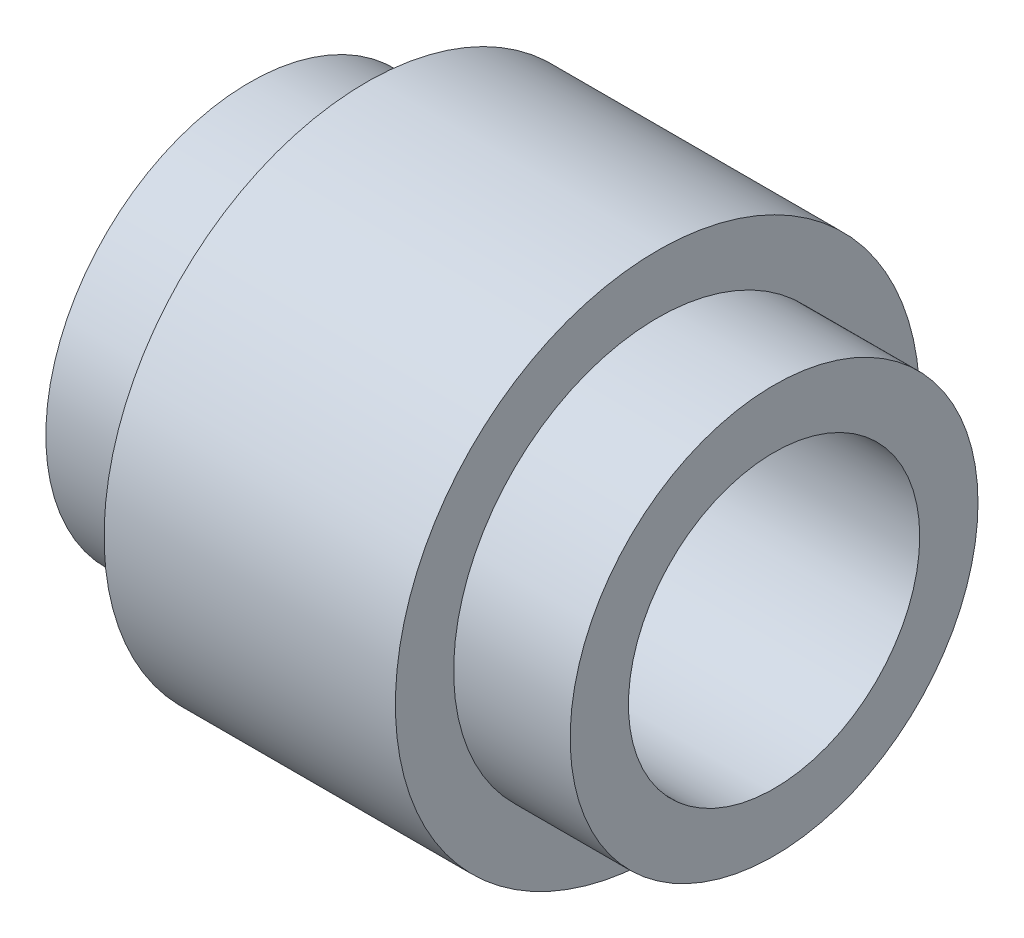
from build123d import *

# Parameters (mm, degrees)
SKETCH1_R           = 114.3
SKETCH1_R_2         = 63.5
BOSS_EXTRUDE1_DEPTH = 63.5
SKETCH2_R           = 88.9
SKETCH2_R_2         = 63.5
BOSS_EXTRUDE2_DEPTH = 50.8


with BuildPart() as part:
    # Sketch1 → Boss-Extrude1 (new, symmetric)
    with BuildSketch(Plane(origin=(0, 0, 0), x_dir=(0, 0, -1), z_dir=(1, 0, 0))):
        Circle(SKETCH1_R)
        Circle(SKETCH1_R_2, mode=Mode.SUBTRACT)
    extrude(amount=BOSS_EXTRUDE1_DEPTH, both=True)

    # Sketch2 → Boss-Extrude2 (add)
    with BuildSketch(Plane(origin=(63.5, 0, 0), x_dir=(0, 0, -1), z_dir=(1, 0, 0))):
        Circle(SKETCH2_R)
        Circle(SKETCH2_R_2, mode=Mode.SUBTRACT)
    boss_extrude2 = extrude(amount=BOSS_EXTRUDE2_DEPTH)

    # Mirror1: Boss-Extrude2 across plane
    add(boss_extrude2.mirror(Plane(origin=(0, 0, 0), x_dir=(0, 0, 1), z_dir=(1, 0, 0))))


solid = part.part
